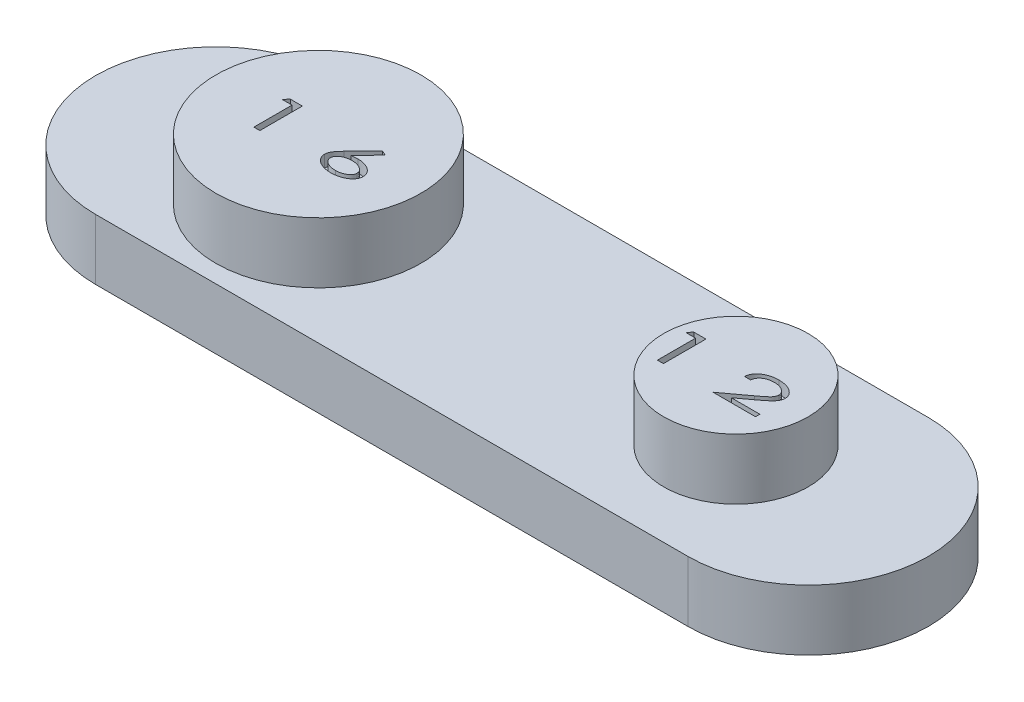
from build123d import *

# Parameters (mm, degrees)
SKETCH_1_R          = 8.45
EXTRUDE_1_DEPTH     = 5
SKETCH_1_R_2        = 5.95
EXTRUDE_1_2_DEPTH   = 5
EXTRUDE_2_DEPTH     = 5
CUT_EXTRUDE_1_DEPTH = 1


with BuildPart() as part:
    # Эскиз1 → Бобышка-Вытянуть1 (new body)
    with BuildSketch(Plane(origin=(0, 0, 0), x_dir=(1, 0, 0), z_dir=(0, 1, 0))):
        with Locations(Location((28.45, 0, 0), (0, 0, 270))):
            Circle(SKETCH_1_R)
    extrude(amount=EXTRUDE_1_DEPTH)



with BuildPart() as body_2:
    # Эскиз1 → Extrude 1 2 (new body)
    with BuildSketch(Plane(origin=(0, 0, 0), x_dir=(1, 0, 0), z_dir=(0, 1, 0))):
        with Locations(Location((62.85, 0, 0), (0, 0, 270))):
            Circle(SKETCH_1_R_2)
    extrude(amount=EXTRUDE_1_2_DEPTH)


with BuildPart() as part_1:
    add(part.part)

    add(body_2.part)  # Бобышка-Вытянуть2 merges body 2
    # Эскиз2 → Бобышка-Вытянуть2 (add)
    with BuildSketch(Plane.XZ):
        with BuildLine():
            Line((20, 9.907075638), (68.8, 9.907075638))
            ThreePointArc((68.8, 9.907075638), (78.707075638, 0), (68.8, -9.907075638))
            Line((68.8, -9.907075638), (20, -9.907075638))
            ThreePointArc((20, -9.907075638), (10.092924362, 0), (20, 9.907075638))
        make_face()
    extrude(amount=EXTRUDE_2_DEPTH)

    # Эскиз3 → Вырез-Вытянуть1 (cut)
    # profile 1 of 4: a face of its own
    with BuildSketch(Plane(origin=(0, 5, 0), x_dir=(1, 0, 0), z_dir=(0, 1, 0))):
        Polygon((24.793504968, 1.33945107), (25.786994551, 1.33945107), (25.786994551, -2.16054893), (25.293404807, -2.16054893), (25.293404807, 0.980476711), (24.4857125, 0.980476711), align=None)
    # profile 2 of 4: a face of its own
    with BuildSketch(Plane(origin=(0, 5, 0), x_dir=(1, 0, 0), z_dir=(0, 1, 0))):
        with BuildLine():
            Line((32.293404807, 1.429194659), (32.710572275, 1.251810845))
            Line((32.710572275, 1.251810845), (31.311834295, -0.173569764))
            add(Edge.make_bspline(
                [(31.311834295, -0.173569764), (31.358089267, -0.16870624), (31.449106443, -0.159136152), (31.583722005, -0.148261845), (31.714231917, -0.142819801), (31.799811063, -0.141813075), (31.841882372, -0.141318161)],
                knots=[0, 0, 0, 0, 1.050463357, 2.067025527, 3.049736174, 4, 4, 4, 4], degree=3))
            add(Edge.make_bspline(
                [(31.841882372, -0.141318161), (31.892631594, -0.142267229), (31.99222418, -0.144129724), (32.138605608, -0.158589791), (32.27929603, -0.181304944), (32.414038197, -0.214346016), (32.542941771, -0.256555014), (32.666249136, -0.307690471), (32.783404279, -0.368889172), (32.893576779, -0.438325379), (32.993809708, -0.515012917), (33.082978333, -0.595686338), (33.157076331, -0.682385029), (33.219332007, -0.772243254), (33.266166231, -0.868006481), (33.301451075, -0.967279847), (33.321115931, -1.071637593), (33.323997691, -1.142443771), (33.325456089, -1.178277296)],
                knots=[0, 0, 0, 0, 1.216705803, 2.387718927, 3.523678273, 4.63141966, 5.710670923, 6.773280217, 7.828534494, 8.8764121, 9.891900874, 10.851678986, 11.753718015, 12.621039212, 13.465630922, 14.302152384, 15.140754866, 16, 16, 16, 16], degree=3))
            add(Edge.make_bspline(
                [(33.325456089, -1.178277296), (33.324649112, -1.203067991), (33.323052653, -1.252111903), (33.314322383, -1.325096867), (33.296779296, -1.395664633), (33.274879702, -1.465032451), (33.244568626, -1.531608596), (33.209857035, -1.597697283), (33.166591193, -1.660828036), (33.118469801, -1.722968922), (33.063433667, -1.781441776), (33.003637936, -1.838085575), (32.938027888, -1.891110065), (32.866300266, -1.940209443), (32.790268893, -1.98724313), (32.708240205, -2.030868214), (32.620920545, -2.07131908), (32.496973038, -2.12088443), (32.334667959, -2.17299132), (32.132164126, -2.217787881), (31.922319519, -2.245035172), (31.780031129, -2.248525047), (31.707968109, -2.25029252)],
                knots=[0, 0, 0, 0, 0.694266506, 1.37348081, 2.052663605, 2.727134956, 3.406695774, 4.097501124, 4.814245915, 5.54585583, 6.295811196, 7.059481652, 7.850328824, 8.654300203, 9.491370774, 10.351890412, 11.253438261, 12.184048604, 14.087541303, 16.017718477, 17.98314371, 20, 20, 20, 20], degree=3))
            add(Edge.make_bspline(
                [(31.707968109, -2.25029252), (31.638242453, -2.248774857), (31.500863993, -2.245784649), (31.298747229, -2.219154366), (31.104522471, -2.175575887), (30.94893517, -2.125691467), (30.830600069, -2.076731583), (30.746585585, -2.037151015), (30.667711665, -1.993500459), (30.593862238, -1.946241734), (30.524342857, -1.896203841), (30.460343675, -1.841584831), (30.400549244, -1.784485475), (30.346596732, -1.723341383), (30.29857234, -1.659895335), (30.256269277, -1.595298769), (30.220211065, -1.529756833), (30.190409311, -1.463063198), (30.168135186, -1.394817251), (30.151846657, -1.325649142), (30.141737187, -1.255463329), (30.140285187, -1.20822427), (30.139558654, -1.184587392)],
                knots=[0, 0, 0, 0, 1.997858131, 3.936322594, 5.831264173, 7.697584424, 8.61068666, 9.500618209, 10.358168364, 11.192537912, 12.012558819, 12.811093147, 13.60226001, 14.380531754, 15.145544463, 15.8813147, 16.591828983, 17.287633347, 17.97186184, 18.646181114, 19.322593365, 20, 20, 20, 20], degree=3))
            add(Edge.make_bspline(
                [(30.139558654, -1.184587392), (30.141010354, -1.148461212), (30.143992871, -1.07424), (30.170433191, -0.962474683), (30.210668193, -0.847943035), (30.257418271, -0.752032079), (30.303448855, -0.672583542), (30.345493396, -0.609418412), (30.393574802, -0.543097993), (30.447774494, -0.473803646), (30.507628343, -0.400704991), (30.575649052, -0.326209947), (30.648169655, -0.24730633), (30.699823774, -0.194914256), (30.726397596, -0.167960789)],
                knots=[0, 0, 0, 0, 1.07928493, 2.21739014, 3.41791122, 4.706067566, 5.401476327, 6.163444467, 6.974466859, 7.851214641, 8.794600008, 9.799511979, 10.867943603, 12, 12, 12, 12], degree=3))
            Line((30.726397596, -0.167960789), (32.293404807, 1.429194659))
        make_face()
        with BuildLine():
            add(Edge.make_bspline(
                [(31.72409391, -0.50029252), (31.686687059, -0.501080701), (31.61316569, -0.502629833), (31.504878885, -0.511422746), (31.401257599, -0.527919716), (31.301698642, -0.549171708), (31.206894461, -0.578232901), (31.116306639, -0.61308708), (31.03028087, -0.654689341), (30.949841333, -0.702085327), (30.875553819, -0.75283791), (30.811765572, -0.808942176), (30.756105392, -0.865996995), (30.711702617, -0.927217765), (30.675782651, -0.990384058), (30.651411322, -1.057005576), (30.635799082, -1.126138423), (30.634040665, -1.173284439), (30.633148397, -1.197207584)],
                knots=[0, 0, 0, 0, 1.260148547, 2.47676148, 3.655814904, 4.792288897, 5.902950622, 6.992061555, 8.05886712, 9.117362627, 10.135025708, 11.083669179, 11.97457227, 12.813789759, 13.624270573, 14.413876465, 15.195158649, 16, 16, 16, 16], degree=3))
            add(Edge.make_bspline(
                [(30.633148397, -1.197207584), (30.63397334, -1.220911327), (30.635600788, -1.26767409), (30.65228977, -1.336259889), (30.677137443, -1.402341191), (30.713256061, -1.46540652), (30.75806742, -1.52627691), (30.814893441, -1.582875558), (30.879812633, -1.638777983), (30.95547461, -1.689540773), (31.037165158, -1.736771136), (31.124039291, -1.778470223), (31.215172446, -1.813652833), (31.310848806, -1.841182824), (31.410240522, -1.864023508), (31.513787009, -1.880042663), (31.621803986, -1.889036026), (31.695097814, -1.890546968), (31.732507372, -1.891318161)],
                knots=[0, 0, 0, 0, 0.795067192, 1.56850922, 2.35898668, 3.160658465, 4.002518143, 4.891065975, 5.84933897, 6.877467259, 7.946991036, 9.018300859, 10.112113065, 11.225373337, 12.360820649, 13.537032575, 14.74288839, 16, 16, 16, 16], degree=3))
            add(Edge.make_bspline(
                [(31.732507372, -1.891318161), (31.769916929, -1.890546968), (31.843210757, -1.889036026), (31.951227734, -1.880042663), (32.054774221, -1.864023508), (32.154165937, -1.841182824), (32.249842297, -1.813652833), (32.340975453, -1.778470223), (32.427849586, -1.736771136), (32.509540133, -1.689540773), (32.58520211, -1.638777983), (32.650121302, -1.582875558), (32.706947323, -1.52627691), (32.751758682, -1.46540652), (32.7878773, -1.402341191), (32.812724973, -1.336259889), (32.829413955, -1.26767409), (32.831041403, -1.220911327), (32.831866346, -1.197207584)],
                knots=[0, 0, 0, 0, 1.25711161, 2.462967425, 3.639179351, 4.774626663, 5.887886935, 6.981699141, 8.053008964, 9.122532741, 10.15066103, 11.108934025, 11.997481857, 12.839341535, 13.64101332, 14.43149078, 15.204932808, 16, 16, 16, 16], degree=3))
            add(Edge.make_bspline(
                [(32.831866346, -1.197207584), (32.831035678, -1.17327311), (32.829396899, -1.126054108), (32.812845199, -1.056957151), (32.787773174, -0.990374239), (32.751268448, -0.926946452), (32.705247376, -0.866261699), (32.648982652, -0.808457936), (32.582984958, -0.752915763), (32.506746968, -0.702038525), (32.424319381, -0.65486529), (32.336786134, -0.613041032), (32.244967712, -0.578384221), (32.149085461, -0.549038911), (32.048539126, -0.528019047), (31.944240152, -0.511456806), (31.835490318, -0.502605038), (31.761734683, -0.501073918), (31.72409391, -0.50029252)],
                knots=[0, 0, 0, 0, 0.797440906, 1.573227087, 2.358328259, 3.165173453, 4.005987165, 4.894092124, 5.851805388, 6.879384734, 7.948399328, 9.019460647, 10.11311689, 11.221031608, 12.362296266, 13.5382162, 14.743642486, 16, 16, 16, 16], degree=3))
        make_face(mode=Mode.SUBTRACT)
    # profile 3 of 4: a face of its own
    with BuildSketch(Plane(origin=(0, 5, 0), x_dir=(1, 0, 0), z_dir=(0, 1, 0))):
        Polygon((58.043504968, 1.33945107), (59.036994551, 1.33945107), (59.036994551, -2.16054893), (58.543404807, -2.16054893), (58.543404807, 0.980476711), (57.7357125, 0.980476711), align=None)
    # profile 4 of 4: a face of its own
    with BuildSketch(Plane(origin=(0, 5, 0), x_dir=(1, 0, 0), z_dir=(0, 1, 0))):
        with BuildLine():
            Line((63.793404807, 0.262527993), (63.299815064, 0.262527993))
            add(Edge.make_bspline(
                [(63.299815064, 0.262527993), (63.302685748, 0.304272872), (63.308353029, 0.386685293), (63.335904802, 0.506532291), (63.376787966, 0.620850297), (63.432490215, 0.72923575), (63.503019568, 0.831628703), (63.586695944, 0.929009643), (63.685917223, 1.019433857), (63.797666345, 1.103493674), (63.919641423, 1.180385429), (64.050289923, 1.246829909), (64.18779246, 1.303032878), (64.331869628, 1.349524387), (64.483407303, 1.385068283), (64.641743727, 1.410854733), (64.807137967, 1.426662516), (64.919604673, 1.428340067), (64.976898397, 1.429194659)],
                knots=[0, 0, 0, 0, 0.888834359, 1.754730004, 2.605381666, 3.465737881, 4.338483601, 5.244280611, 6.190581454, 7.187738409, 8.215210836, 9.253401094, 10.301115364, 11.371646232, 12.470031537, 13.608395622, 14.781649024, 16, 16, 16, 16], degree=3))
            add(Edge.make_bspline(
                [(64.976898397, 1.429194659), (65.03348754, 1.428292805), (65.144060888, 1.426530612), (65.305705133, 1.411613183), (65.458846378, 1.387065881), (65.604196501, 1.353882665), (65.74076223, 1.309535913), (65.869643199, 1.256316502), (65.989577852, 1.19224369), (66.100756817, 1.119676956), (66.2007498, 1.040562941), (66.288817089, 0.957276306), (66.363715766, 0.870506523), (66.424384359, 0.779442875), (66.472321897, 0.685244878), (66.506107777, 0.587379713), (66.526347071, 0.485611736), (66.529160382, 0.416631795), (66.530584295, 0.381718698)],
                knots=[0, 0, 0, 0, 1.310756488, 2.561175642, 3.756560902, 4.901738993, 6.011216911, 7.079041313, 8.12778179, 9.156415128, 10.150780717, 11.077522728, 11.960732363, 12.800125033, 13.606405671, 14.402570702, 15.191486623, 16, 16, 16, 16], degree=3))
            add(Edge.make_bspline(
                [(66.530584295, 0.381718698), (66.529761035, 0.357162671), (66.528116941, 0.308122947), (66.519459026, 0.234905794), (66.501835313, 0.163422103), (66.479754811, 0.09253065), (66.449740241, 0.023511248), (66.415072306, -0.045384491), (66.371427863, -0.111540229), (66.32242158, -0.178962719), (66.263430767, -0.248139769), (66.192819869, -0.321682486), (66.11011654, -0.401013763), (66.015954283, -0.487191475), (65.90854747, -0.577440405), (65.789953115, -0.674679721), (65.658514658, -0.776917119), (65.566178208, -0.846316894), (65.518164423, -0.882403898)],
                knots=[0, 0, 0, 0, 0.701848097, 1.40162889, 2.101250406, 2.802272313, 3.520289444, 4.248907007, 5.00269453, 5.781239201, 6.629285482, 7.597407261, 8.692874805, 9.902814045, 11.243302259, 12.700063145, 14.284074618, 16, 16, 16, 16], degree=3))
            Line((65.518164423, -0.882403898), (64.272972115, -1.801574571))
            Line((64.272972115, -1.801574571), (66.620327884, -1.801574571))
            Line((66.620327884, -1.801574571), (66.620327884, -2.16054893))
            Line((66.620327884, -2.16054893), (63.120327884, -2.16054893))
            Line((63.120327884, -2.16054893), (65.081365545, -0.712031302))
            add(Edge.make_bspline(
                [(65.081365545, -0.712031302), (65.128891289, -0.677555855), (65.220079351, -0.611407513), (65.349753024, -0.514587896), (65.466791204, -0.425356862), (65.57040242, -0.342416148), (65.66045611, -0.265958329), (65.738907657, -0.197674018), (65.803536044, -0.135456286), (65.856158873, -0.078763039), (65.899928944, -0.025421721), (65.936074251, 0.027844663), (65.967595202, 0.08146117), (65.992593284, 0.136069158), (66.012590409, 0.191119345), (66.026687575, 0.24700294), (66.035339091, 0.303622145), (66.036444507, 0.34172528), (66.036994551, 0.360685044)],
                knots=[0, 0, 0, 0, 1.894334781, 3.634676748, 5.221274361, 6.642664372, 7.916130238, 9.032651819, 9.997858999, 10.808939575, 11.527303582, 12.221680454, 12.88386773, 13.531644697, 14.156547488, 14.771036415, 15.388479188, 16, 16, 16, 16], degree=3))
            add(Edge.make_bspline(
                [(66.036994551, 0.360685044), (66.036075942, 0.384601152), (66.034256829, 0.431961977), (66.018916269, 0.50141451), (65.994072779, 0.56816938), (65.959116637, 0.632359362), (65.914940086, 0.694579648), (65.859155231, 0.752525326), (65.79499846, 0.808952055), (65.722058543, 0.86225808), (65.641832395, 0.911008091), (65.556466689, 0.953676936), (65.466621995, 0.989678009), (65.372358326, 1.019048258), (65.27351681, 1.042297978), (65.170109144, 1.058041948), (65.06263597, 1.068158812), (64.989541879, 1.069525215), (64.952359134, 1.0702203)],
                knots=[0, 0, 0, 0, 0.804147254, 1.592444627, 2.381369562, 3.194277557, 4.045511985, 4.941362025, 5.894362084, 6.91848291, 7.97738088, 9.050208499, 10.126634048, 11.231141279, 12.370116625, 13.54038185, 14.748799641, 16, 16, 16, 16], degree=3))
            add(Edge.make_bspline(
                [(64.952359134, 1.0702203), (64.913311298, 1.069505084), (64.836726242, 1.068102319), (64.724263764, 1.058332684), (64.616801057, 1.041420119), (64.514361279, 1.018495096), (64.416807833, 0.988901352), (64.324216722, 0.952744964), (64.23697642, 0.908842975), (64.155163304, 0.859457481), (64.079867072, 0.804301827), (64.012835596, 0.74298498), (63.954288739, 0.676333603), (63.904905037, 0.603818309), (63.862971088, 0.526570921), (63.831110788, 0.443221983), (63.806627748, 0.354958241), (63.797870601, 0.29374453), (63.793404807, 0.262527993)],
                knots=[0, 0, 0, 0, 1.20340566, 2.360256049, 3.475759387, 4.553895236, 5.592896754, 6.614780108, 7.613348246, 8.599105318, 9.557104039, 10.48495144, 11.393589009, 12.284641916, 13.183722619, 14.095950191, 15.029010964, 16, 16, 16, 16], degree=3))
        make_face()
    extrude(amount=-CUT_EXTRUDE_1_DEPTH, mode=Mode.SUBTRACT)


solid = part_1.part
